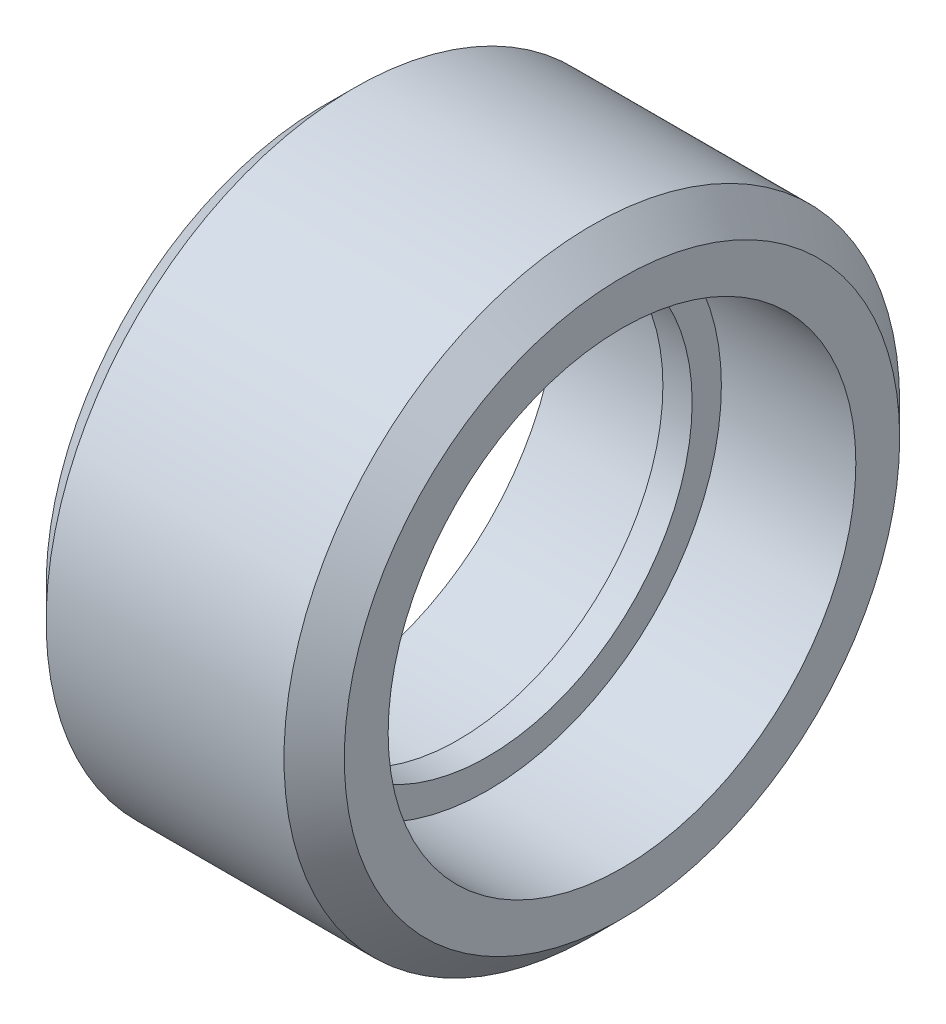
from build123d import *

# Parameters (mm, degrees)
SCALE1_SCALE = 1.142857143
SCALE2_SCALE = 0.997091816


with BuildPart() as part:
    # Sketch1 → Revolve1 (revolve)
    with BuildSketch(Plane.XY, mode=Mode.PRIVATE) as revolve1_sk:
        Polygon((0, 7), (-0.5, 7), (-0.5, 8), (-5.1, 8), (-5.1, 9.5), (-4.068629558, 10.531370442), (0, 10.531370442), align=None)
    revolve1 = revolve(revolve1_sk.sketch.rotate(Axis((0, 0, 0), (-1, 0, 0)), 90), axis=Axis((0, 0, 0), (-1, 0, 0)))

    # Mirror1: Revolve1 across plane
    add(revolve1.mirror(Plane(origin=(0, 10.531370442, 0), x_dir=(0, 0, 1), z_dir=(1, 0, 0))))


with BuildPart() as part_1:
    # Scale1: scaled about (0, 0, 0)
    add(part.part.scale(SCALE1_SCALE))


with BuildPart() as part_2:
    # Scale2: scaled about (0, 0, 0)
    add(part_1.part.scale(SCALE2_SCALE))


solid = part_2.part
